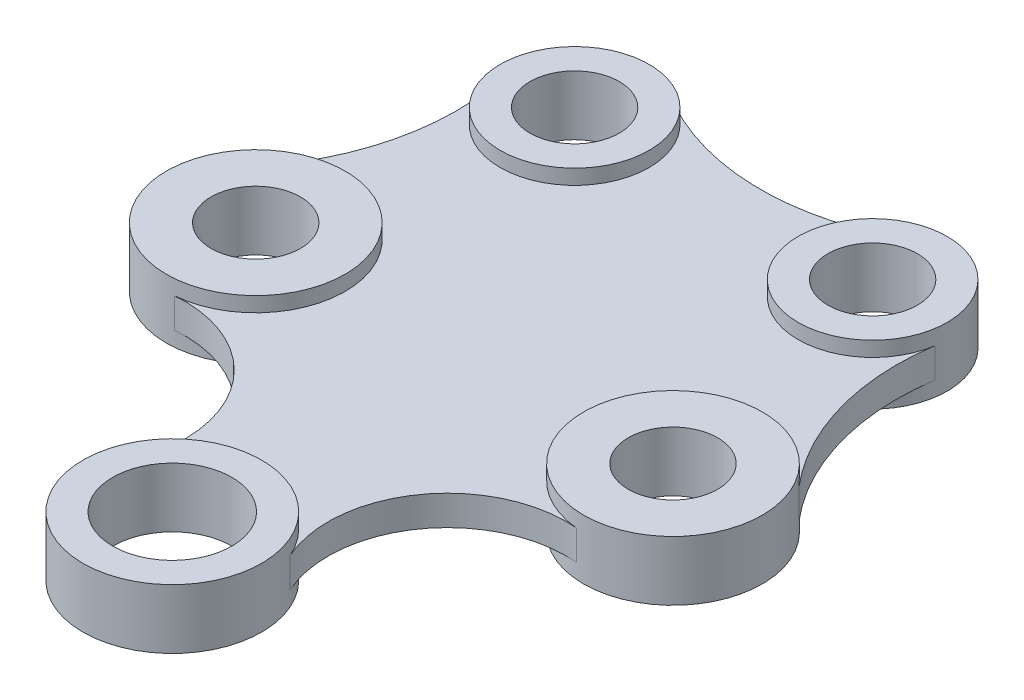
from build123d import *

# Parameters (mm, degrees)
SKETCH1_R                = 15
SKETCH1_R_2              = 20
BOSS_EXTRUDE2_DEPTH      = 10
BOSS_EXTRUDE3_DEPTH      = 5
BOSS_EXTRUDE3_DEPTH_BACK = 15
SKETCH3_R                = 25
SKETCH3_R_2              = 30
SKETCH1_4_R              = 15
SKETCH1_4_R_2            = 20
CUT_EXTRUDE1_DEPTH       = 25


with BuildPart() as part:
    # Sketch1 → Boss-Extrude2 (new body)
    with BuildSketch(Plane(origin=(0, 0, 0), x_dir=(1, 0, 0), z_dir=(0, 1, 0))):
        with BuildLine():
            ThreePointArc((-38.095238, 108.983554), (-64.373951, 107.454573), (-74.716931, 83.248556))
            ThreePointArc((-74.716931, 83.248556), (-76.859584, 49.370141), (-92.857575, 19.430164))
            ThreePointArc((-92.857575, 19.430164), (-96.668829, -13.73949), (-67.447729, -29.891235))
            ThreePointArc((-67.447729, -29.891235), (-31.495361, -46.496686), (-27.447729, -85.891235))
            ThreePointArc((-27.447729, -85.891235), (0, -128), (27.447729, -85.891235))
            ThreePointArc((27.447729, -85.891235), (31.495361, -46.496686), (67.447729, -29.891235))
            ThreePointArc((67.447729, -29.891235), (96.668829, -13.73949), (92.857575, 19.430164))
            ThreePointArc((92.857575, 19.430164), (76.859584, 49.370141), (74.716931, 83.248556))
            ThreePointArc((74.716931, 83.248556), (64.373951, 107.454573), (38.095238, 108.983554))
            ThreePointArc((38.095238, 108.983554), (0, 99.330927), (-38.095238, 108.983554))
        make_face()
        with Locations((-50, 87)):
            Circle(SKETCH1_R, mode=Mode.SUBTRACT)
        with Locations((-70, 0)):
            Circle(SKETCH1_R, mode=Mode.SUBTRACT)
        with Locations((0, -98)):
            Circle(SKETCH1_R_2, mode=Mode.SUBTRACT)
        with Locations((70, 0)):
            Circle(SKETCH1_R, mode=Mode.SUBTRACT)
        with Locations((50, 87)):
            Circle(SKETCH1_R, mode=Mode.SUBTRACT)
    extrude(amount=BOSS_EXTRUDE2_DEPTH)

    # Sketch3 → Boss-Extrude3 (add, two sides: drawn at the far end of the back side and taken through both)
    with BuildSketch(Plane(origin=(0, 10, 0), x_dir=(1, 0, 0), z_dir=(0, 1, 0)).offset(-BOSS_EXTRUDE3_DEPTH_BACK)):
        with Locations((-50, 87)):
            Circle(SKETCH3_R)
        with Locations((50, 87)):
            Circle(SKETCH3_R)
        with Locations((70, 0)):
            Circle(SKETCH3_R_2)
        with Locations((0, -98)):
            Circle(SKETCH3_R_2)
        with Locations((-70, 0)):
            Circle(SKETCH3_R_2)
    extrude(amount=BOSS_EXTRUDE3_DEPTH + BOSS_EXTRUDE3_DEPTH_BACK)

    # Sketch1<4> → Cut-Extrude1 (cut, symmetric)
    with BuildSketch(Plane(origin=(0, 0, 0), x_dir=(1, 0, 0), z_dir=(0, 1, 0))):
        with Locations((-50, 87)):
            Circle(SKETCH1_4_R)
        with Locations((-70, 0)):
            Circle(SKETCH1_4_R)
        with Locations((0, -98)):
            Circle(SKETCH1_4_R_2)
        with Locations((70, 0)):
            Circle(SKETCH1_4_R)
        with Locations((50, 87)):
            Circle(SKETCH1_4_R)
    extrude(amount=CUT_EXTRUDE1_DEPTH, both=True, mode=Mode.SUBTRACT)


solid = part.part
